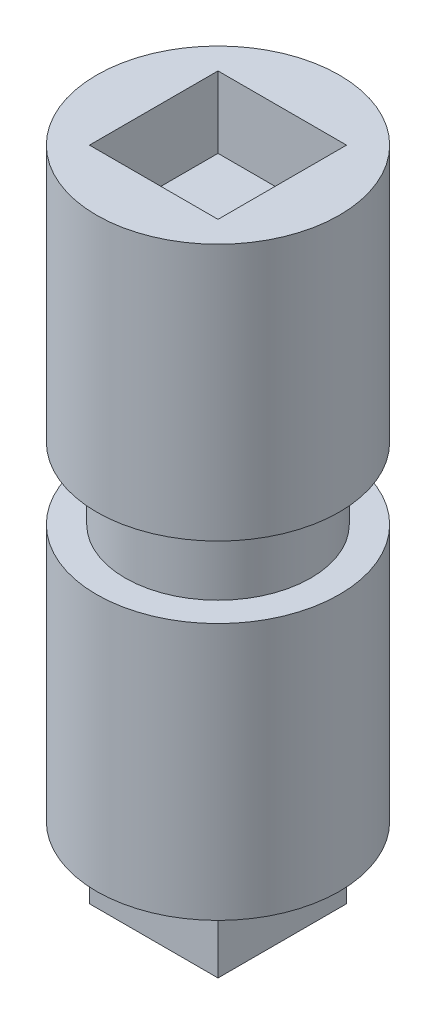
from build123d import *

# Parameters (mm, degrees)
SKETCH1_R           = 85
BOSS_EXTRUDE2_DEPTH = 180
SKETCH2_W           = 90
SKETCH2_H           = 90
BOSS_EXTRUDE3_DEPTH = 50
SKETCH4_R           = 65
BOSS_EXTRUDE4_DEPTH = 50
SKETCH5_R           = 85
BOSS_EXTRUDE5_DEPTH = 180
SKETCH6_W           = 90
SKETCH6_H           = 90
CUT_EXTRUDE2_DEPTH  = 50


with BuildPart() as part:
    # Sketch1 → Boss-Extrude2 (new body)
    with BuildSketch(Plane(origin=(0, 0, 0), x_dir=(1, 0, 0), z_dir=(0, 1, 0))):
        with Locations(Location((0, 0, 0), (0, 0, 90))):
            Circle(SKETCH1_R)
    extrude(amount=BOSS_EXTRUDE2_DEPTH)

    # Sketch2 → Boss-Extrude3 (add)
    with BuildSketch(Plane.XZ):
        Rectangle(SKETCH2_W, SKETCH2_H)
    extrude(amount=BOSS_EXTRUDE3_DEPTH)

    # Sketch4 → Boss-Extrude4 (add)
    with BuildSketch(Plane(origin=(0, 180, 0), x_dir=(1, 0, 0), z_dir=(0, 1, 0))):
        with Locations(Location((0, 0, 0), (0, 0, 270))):
            Circle(SKETCH4_R)
    extrude(amount=BOSS_EXTRUDE4_DEPTH)

    # Sketch5 → Boss-Extrude5 (add)
    with BuildSketch(Plane(origin=(0, 230, 0), x_dir=(1, 0, 0), z_dir=(0, 1, 0))):
        with Locations(Location((0, 0, 0), (0, 0, 90))):
            Circle(SKETCH5_R)
    extrude(amount=BOSS_EXTRUDE5_DEPTH)

    # Sketch6 → Cut-Extrude2 (cut)
    with BuildSketch(Plane(origin=(0, 410, 0), x_dir=(1, 0, 0), z_dir=(0, 1, 0))):
        Rectangle(SKETCH6_W, SKETCH6_H)
    extrude(amount=-CUT_EXTRUDE2_DEPTH, mode=Mode.SUBTRACT)


solid = part.part
